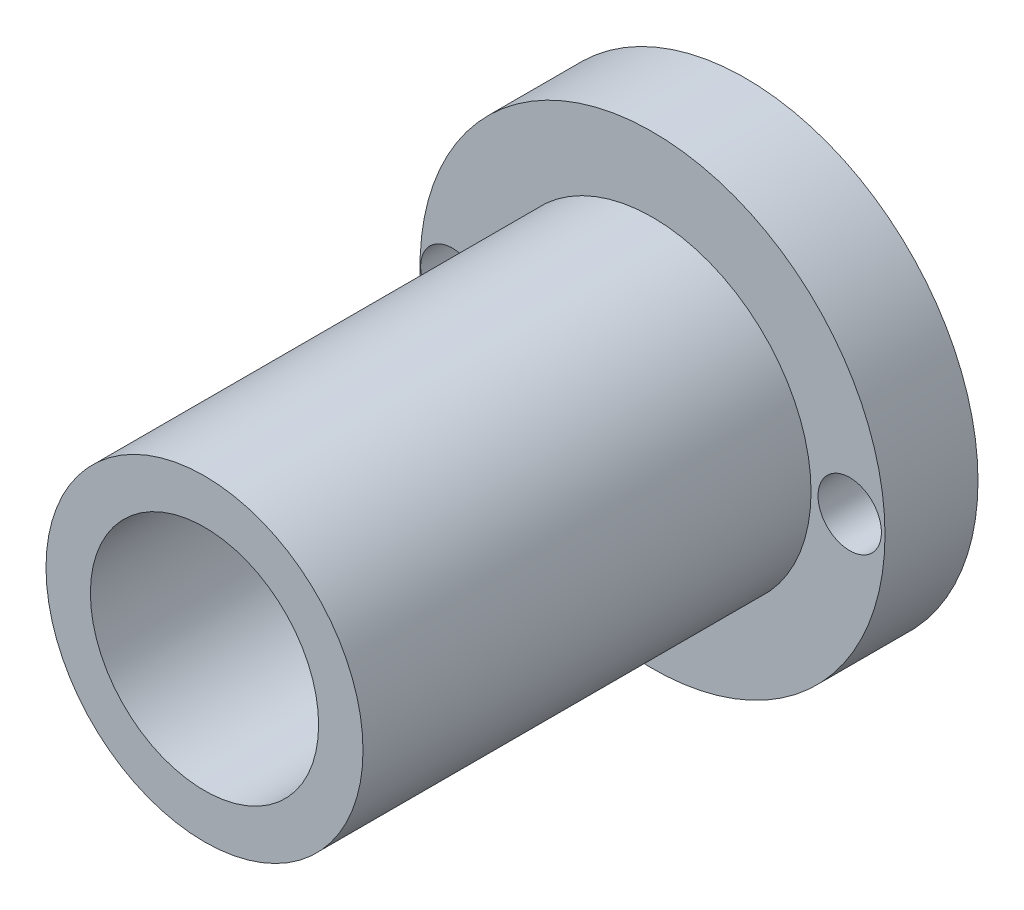
from build123d import *

# Parameters (mm, degrees)
SKETCH_2_R          = 55
EXTRUDE_2_DEPTH     = 22
SKETCH_4_R          = 37.5
SKETCH_4_R_2        = 27
EXTRUDE_3_DEPTH     = 106
CUT_EXTRUDE_1_DEPTH = 132.476233594
SKETCH_6_R          = 27
CUT_EXTRUDE_2_DEPTH = 132.476233594


with BuildPart() as part:
    # 草图2 → 凸台-拉伸2 (new body)
    with BuildSketch(Plane.XY):
        Circle(SKETCH_2_R)
    extrude(amount=EXTRUDE_2_DEPTH)

    # 草图4 → 凸台-拉伸3 (add)
    with BuildSketch(Plane.XY.offset(22)):
        Circle(SKETCH_4_R)
        Circle(SKETCH_4_R_2, mode=Mode.SUBTRACT)
    extrude(amount=EXTRUDE_3_DEPTH)

    # 草图5 → 切除-拉伸1 (cut, through all)
    with BuildSketch(Plane.XY.offset(22)):
        with BuildLine():
            ThreePointArc((-54.856374593, 0), (-47.356374593, -7.5), (-39.856374593, 0))
            Line((-39.856374593, 0), (-54.856374593, 0))
        make_face()
        with BuildLine():
            Line((-54.856374593, 0), (-39.856374593, 0))
            ThreePointArc((-39.856374593, 0), (-47.356374593, 7.5), (-54.856374593, 0))
        make_face()
        with BuildLine():
            ThreePointArc((54.149750432, 0), (46.649750432, 7.5), (39.149750432, 0))
            Line((39.149750432, 0), (54.149750432, 0))
        make_face()
        with BuildLine():
            Line((54.149750432, 0), (39.149750432, 0))
            ThreePointArc((39.149750432, 0), (46.649750432, -7.5), (54.149750432, 0))
        make_face()
    extrude(amount=-CUT_EXTRUDE_1_DEPTH, mode=Mode.SUBTRACT)

    # 草图6 → 切除-拉伸2 (cut, through all)
    with BuildSketch(Plane.XY.offset(22)):
        Circle(SKETCH_6_R)
    extrude(amount=-CUT_EXTRUDE_2_DEPTH, mode=Mode.SUBTRACT)


solid = part.part
